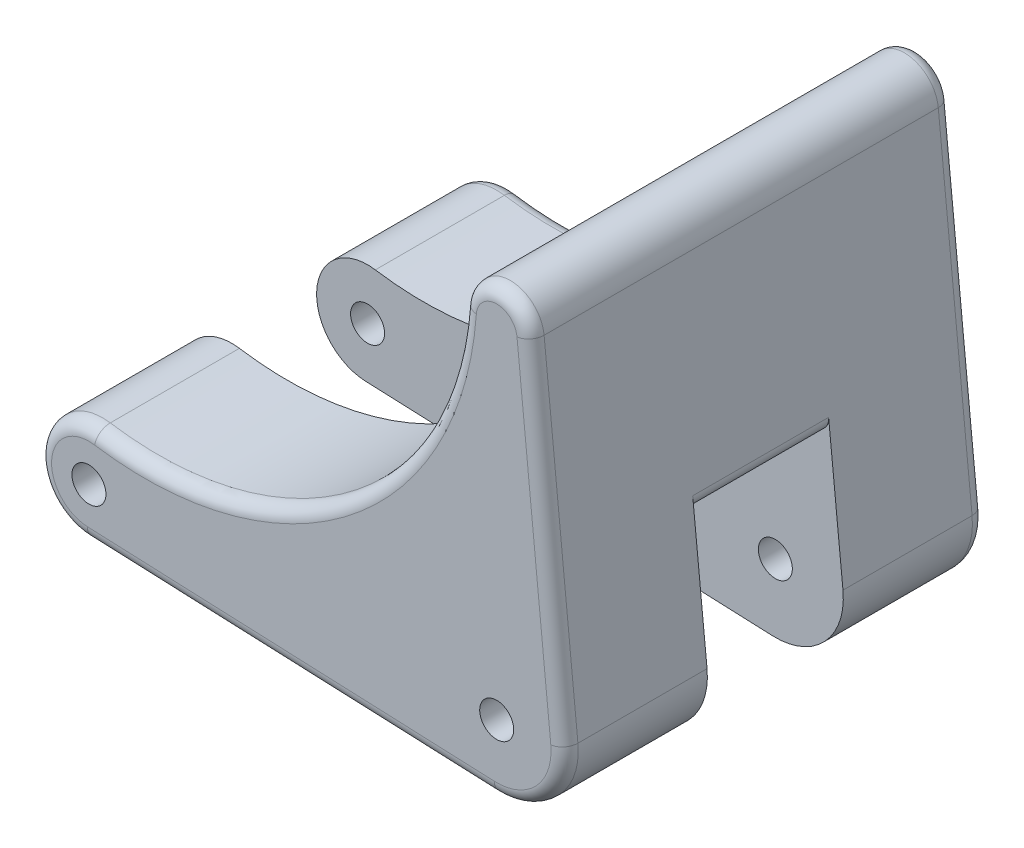
from build123d import *

# Parameters (mm, degrees)
SKETCH1_R           = 3.175
BOSS_EXTRUDE1_DEPTH = 39.37
SKETCH3_W           = 153.048335432
SKETCH3_H           = 25.4
CUT_EXTRUDE1_DEPTH  = 38.1
FILLET1_R           = 2.54
FILLET2_R           = 2.54


with BuildPart() as part:
    # Sketch1 → Boss-Extrude1 (new, symmetric)
    with BuildSketch(Plane.XY):
        with BuildLine():
            Line((-76.596875, -9.516728179), (-0.529166667, -12.688970905))
            ThreePointArc((-0.529166667, -12.688970905), (9.239000565, -8.713832025), (12.636340451, 1.27))
            Line((12.636340451, 1.27), (6.318170226, 64.135))
            ThreePointArc((6.318170226, 64.135), (-0.08833437, 69.849385564), (-6.333390084, 63.95898807))
            ThreePointArc((-6.333390084, 63.95898807), (-28.602299903, 21.707467551), (-74.754015102, 9.414603161))
            ThreePointArc((-74.754015102, 9.414603161), (-85.680189052, 0.922843719), (-76.596875, -9.516728179))
        make_face()
        with Locations((-76.2, 0)):
            Circle(SKETCH1_R, mode=Mode.SUBTRACT)
        Circle(SKETCH1_R, mode=Mode.SUBTRACT)
    extrude(amount=BOSS_EXTRUDE1_DEPTH, both=True)

    # Sketch3 → Cut-Extrude1 (cut)
    with BuildSketch(Plane(origin=(-0.529166667, -12.688970905, 0), x_dir=(0.9991315673568165, -0.04166666666666664, 0), z_dir=(-0.04166666666666664, -0.9991315673568165, 0))):
        with Locations((-41.471397415, 0)):
            Rectangle(SKETCH3_W, SKETCH3_H)
    extrude(amount=-CUT_EXTRUDE1_DEPTH, mode=Mode.SUBTRACT)

    # Fillet1
    fillet1_edges = [part.edges().sort_by_distance(p)[0] for p in [
        (-23.382807479, 26.397207842, 0),
        (10.25193425, 24.994542149, 0),
    ]]
    fillet(fillet1_edges, radius=FILLET1_R)

    # Fillet2
    fillet2_edges = [part.edges().sort_by_distance(p)[0] for p in [
        (-0.08833437, 69.849385564, 39.37),
        (-28.602299903, 21.707467551, 39.37),
        (-85.680189052, 0.922843719, 39.37),
        (-38.563020833, -11.102849542, 39.37),
        (9.239000565, -8.713832025, 39.37),
        (-38.563020833, -11.102849542, -39.37),
        (-85.680189052, 0.922843719, -39.37),
        (-28.602299903, 21.707467551, -39.37),
        (9.477255338, 32.7025, 39.37),
        (-0.08833437, 69.849385564, -39.37),
        (9.477255338, 32.7025, -39.37),
        (9.239000565, -8.713832025, -39.37),
    ]]
    fillet(fillet2_edges, radius=FILLET2_R)


solid = part.part
